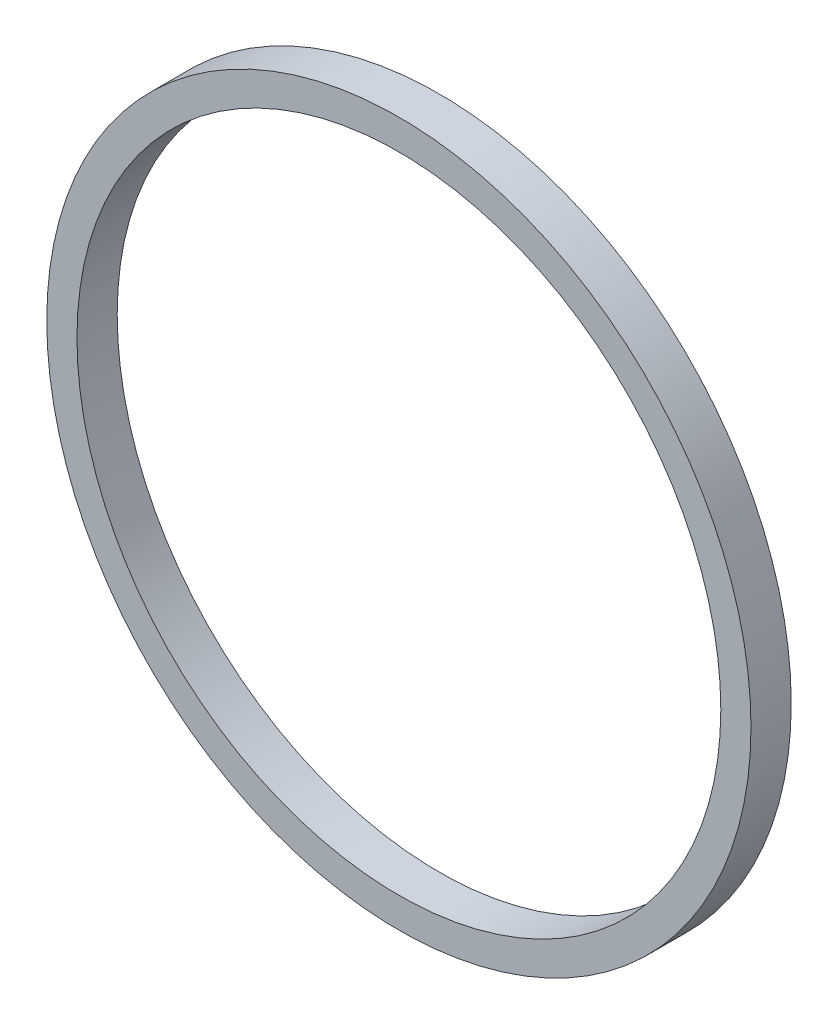
from build123d import *

# Parameters (mm, degrees)
SKETCH1_R           = 17.5
SKETCH1_R_2         = 16
BOSS_EXTRUDE1_DEPTH = 2


with BuildPart() as part:
    # Sketch1 → Boss-Extrude1 (new body)
    with BuildSketch(Plane.XY):
        Circle(SKETCH1_R)
        Circle(SKETCH1_R_2, mode=Mode.SUBTRACT)
    extrude(amount=BOSS_EXTRUDE1_DEPTH)


solid = part.part
